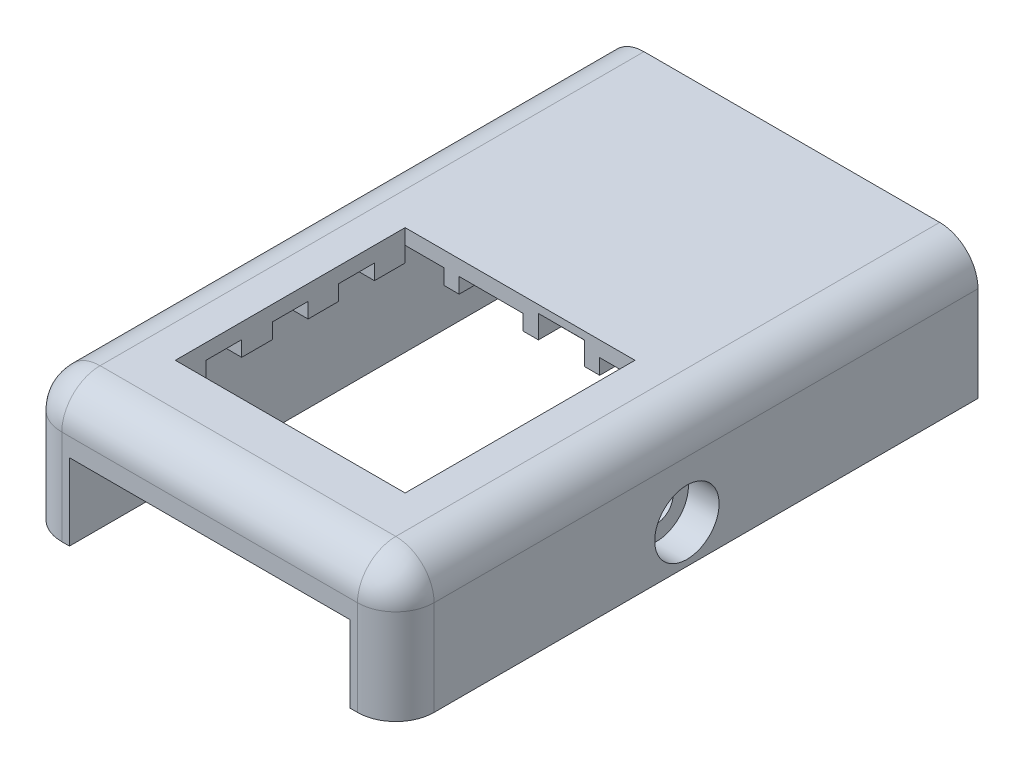
from build123d import *

# Parameters (mm, degrees)
SKETCH1_W                  = 24.3
SKETCH1_H                  = 38
BASE_DEPTH                 = 2
SKETCH2_W                  = 24.3
SKETCH2_H                  = 38
SKETCH2_W_2                = 18.3
SKETCH2_H_2                = 31.3
PCB_EDGE_WALLS_DEPTH       = 1.7
SKETCH3_R                  = 0.95
PCB_MOUNT_DOWELS_DEPTH     = 1.6
SKETCH4_W                  = 15
SKETCH4_H                  = 15
SILICONE_PAD_HOLE_DEPTH    = 44.385510254
SKETCH6_W                  = 10.4
SKETCH6_H                  = 2.8
WIRE_SOLDERINGS_HOLE_DEPTH = 1.5
SKETCH7_W                  = 3
SKETCH7_H                  = 1.5
CUT_EXTRUDE4_DEPTH         = 1.5
SILICONE_CHANNELS_START    = -1
SKETCH5_R                  = 0.95
SKETCH5_W                  = 5
SKETCH5_H                  = 2.49
SKETCH5_W_2                = 1
SKETCH5_H_2                = 2
SILICONE_CHANNELS_DEPTH    = 1
SKETCH8_W                  = 23.48
SKETCH8_H                  = 1
CUT_EXTRUDE5_DEPTH         = 1
SKETCH9_W                  = 23.48
SKETCH9_H                  = 1
CUT_EXTRUDE6_DEPTH         = 1
FILLET1_R                  = 0.7
SKETCH17_W                 = 3
SKETCH17_H                 = 38
BOSS_EXTRUDE4_DEPTH        = 5
SKETCH19_R                 = 1.1
CUT_EXTRUDE9_DEPTH         = 5
SKETCH20_R                 = 2.1
CUT_EXTRUDE10_DEPTH        = 2
SKETCH21_R                 = 1.1
CUT_EXTRUDE11_DEPTH        = 5
SKETCH22_R                 = 2.1
CUT_EXTRUDE12_DEPTH        = 2
FILLET3_R                  = 2.5


with BuildPart() as part:
    # Sketch1 → base (new body)
    with BuildSketch(Plane(origin=(0, 0, 0), x_dir=(1, 0, 0), z_dir=(0, 1, 0))):
        with Locations((9, 18.7)):
            Rectangle(SKETCH1_W, SKETCH1_H)
    extrude(amount=BASE_DEPTH)

    # Sketch2 → pcb_edge_walls (add)
    with BuildSketch(Plane.XZ):
        with Locations((9, -18.7)):
            Rectangle(SKETCH2_W, SKETCH2_H)
        with Locations((9, -15.5)):
            Rectangle(SKETCH2_W_2, SKETCH2_H_2, mode=Mode.SUBTRACT)
    extrude(amount=PCB_EDGE_WALLS_DEPTH)

    # Sketch3 → pcb_mount_dowels (add)
    with BuildSketch(Plane.XZ):
        with Locations(Location((1.5, -29.46, 0), (0, 0, 90))):
            Circle(SKETCH3_R)
        with Locations(Location((16.5, -29.46, 0), (0, 0, 90))):
            Circle(SKETCH3_R)
        with Locations(Location((9, -3, 0), (0, 0, 90))):
            Circle(SKETCH3_R)
    extrude(amount=PCB_MOUNT_DOWELS_DEPTH)

    # Sketch4 → silicone_pad_hole (cut, through all)
    with BuildSketch(Plane(origin=(0, 2, 0), x_dir=(1, 0, 0), z_dir=(0, 1, 0))):
        with Locations((9, 12.46)):
            Rectangle(SKETCH4_W, SKETCH4_H)
    extrude(amount=-SILICONE_PAD_HOLE_DEPTH, mode=Mode.SUBTRACT)

    # Sketch6 → wire_solderings_hole (cut)
    with BuildSketch(Plane.XZ):
        with Locations((9, -26.6)):
            Rectangle(SKETCH6_W, SKETCH6_H)
    extrude(amount=-WIRE_SOLDERINGS_HOLE_DEPTH, mode=Mode.SUBTRACT)

    # Sketch7 → Cut-Extrude4 (cut)
    with BuildSketch(Plane.XZ):
        with Locations((11.7, -20.7)):
            Rectangle(SKETCH7_W, SKETCH7_H)
    extrude(amount=-CUT_EXTRUDE4_DEPTH, mode=Mode.SUBTRACT)

    # Sketch5 → silicone_channels (cut)
    with BuildSketch(Plane.XZ.offset(SILICONE_CHANNELS_START)):
        Polygon((-0.15, -19.96), (-0.15, -24.2), (18.15, -24.2), (18.15, -0.72), (-0.15, -0.72), align=None)
        with Locations(Location((9, -3, 0), (0, 0, 270))):
            Circle(SKETCH5_R, mode=Mode.SUBTRACT)
        with Locations((11.7, -21.205)):
            Rectangle(SKETCH5_W, SKETCH5_H, mode=Mode.SUBTRACT)
        Polygon((4.025, -19.96), (4.025, -21.45), (2.525, -21.45), (2.525, -22.45), (6.525, -22.45), (6.525, -21.45), (5.025, -21.45), (5.025, -19.96), align=None, mode=Mode.SUBTRACT)
        Polygon((3.858394778, -4.96), (3.858394778, -3.47), (2.358394778, -3.47), (2.358394778, -2.47), (6.358394778, -2.47), (6.358394778, -3.47), (4.858394778, -3.47), (4.858394778, -4.96), align=None, mode=Mode.SUBTRACT)
        Polygon((13.141605222, -4.96), (13.141605222, -3.47), (11.641605222, -3.47), (11.641605222, -2.47), (15.641605222, -2.47), (15.641605222, -3.47), (14.141605222, -3.47), (14.141605222, -4.96), align=None, mode=Mode.SUBTRACT)
        with Locations((1, -5.96)):
            Rectangle(SKETCH5_W_2, SKETCH5_H_2, mode=Mode.SUBTRACT)
        with Locations((1, -10.293333333)):
            Rectangle(SKETCH5_W_2, SKETCH5_H_2, mode=Mode.SUBTRACT)
        with Locations((1, -14.626666667)):
            Rectangle(SKETCH5_W_2, SKETCH5_H_2, mode=Mode.SUBTRACT)
        with Locations((1, -18.96)):
            Rectangle(SKETCH5_W_2, SKETCH5_H_2, mode=Mode.SUBTRACT)
        with Locations((17, -18.96)):
            Rectangle(SKETCH5_W_2, SKETCH5_H_2, mode=Mode.SUBTRACT)
        with Locations((17, -14.626666667)):
            Rectangle(SKETCH5_W_2, SKETCH5_H_2, mode=Mode.SUBTRACT)
        with Locations((17, -10.293333333)):
            Rectangle(SKETCH5_W_2, SKETCH5_H_2, mode=Mode.SUBTRACT)
        with Locations((17, -5.96)):
            Rectangle(SKETCH5_W_2, SKETCH5_H_2, mode=Mode.SUBTRACT)
    extrude(amount=SILICONE_CHANNELS_DEPTH, mode=Mode.SUBTRACT)

    # Sketch8 → Cut-Extrude5 (cut)
    with BuildSketch(Plane(origin=(-0.15, 0, 0), x_dir=(0, 0, -1), z_dir=(1, 0, 0))):
        with Locations((12.46, 0.5)):
            Rectangle(SKETCH8_W, SKETCH8_H)
    extrude(amount=-CUT_EXTRUDE5_DEPTH, mode=Mode.SUBTRACT)

    # Sketch9 → Cut-Extrude6 (cut)
    with BuildSketch(Plane.ZY.offset(-18.15)):
        with Locations((-12.46, 0.5)):
            Rectangle(SKETCH9_W, SKETCH9_H)
    extrude(amount=-CUT_EXTRUDE6_DEPTH, mode=Mode.SUBTRACT)

    # Fillet1
    fillet1_edges = [part.edges().sort_by_distance(p)[0] for p in [
        (-1.15, 0, -12.46),
        (19.15, 0, -12.46),
    ]]
    fillet(fillet1_edges, radius=FILLET1_R)

    # Sketch17 → Boss-Extrude4 (add)
    with BuildSketch(Plane.XZ.offset(1.7)):
        with Locations((-1.65, -18.7)):
            Rectangle(SKETCH17_W, SKETCH17_H)
        with Locations((19.65, -18.7)):
            Rectangle(SKETCH17_W, SKETCH17_H)
    extrude(amount=BOSS_EXTRUDE4_DEPTH)

    # Sketch19 → Cut-Extrude9 (cut)
    with BuildSketch(Plane.ZY.offset(3.15)):
        with Locations((-4.7, -4.2)):
            Circle(SKETCH19_R)
        with Locations((-32.7, -4.2)):
            Circle(SKETCH19_R)
    extrude(amount=-CUT_EXTRUDE9_DEPTH, mode=Mode.SUBTRACT)

    # Sketch20 → Cut-Extrude10 (cut)
    with BuildSketch(Plane.ZY.offset(3.15)):
        with Locations((-4.7, -4.2)):
            Circle(SKETCH20_R)
        with Locations((-32.7, -4.2)):
            Circle(SKETCH20_R)
    extrude(amount=-CUT_EXTRUDE10_DEPTH, mode=Mode.SUBTRACT)

    # Sketch21 → Cut-Extrude11 (cut)
    with BuildSketch(Plane(origin=(21.15, 0, 0), x_dir=(0, 0, -1), z_dir=(1, 0, 0))):
        with Locations((18.7, -4.2)):
            Circle(SKETCH21_R)
    extrude(amount=-CUT_EXTRUDE11_DEPTH, mode=Mode.SUBTRACT)

    # Sketch22 → Cut-Extrude12 (cut)
    with BuildSketch(Plane(origin=(21.15, 0, 0), x_dir=(0, 0, -1), z_dir=(1, 0, 0))):
        with Locations((18.7, -4.2)):
            Circle(SKETCH22_R)
    extrude(amount=-CUT_EXTRUDE12_DEPTH, mode=Mode.SUBTRACT)

    # Fillet3
    fillet3_edges = [part.edges().sort_by_distance(p)[0] for p in [
        (21.15, 2, -18.7),
        (-3.15, 2, -18.7),
        (21.15, -4.2, 0.3),
        (-3.15, -4.2, 0.3),
        (9, 2, 0.3),
    ]]
    fillet(fillet3_edges, radius=FILLET3_R)


solid = part.part
